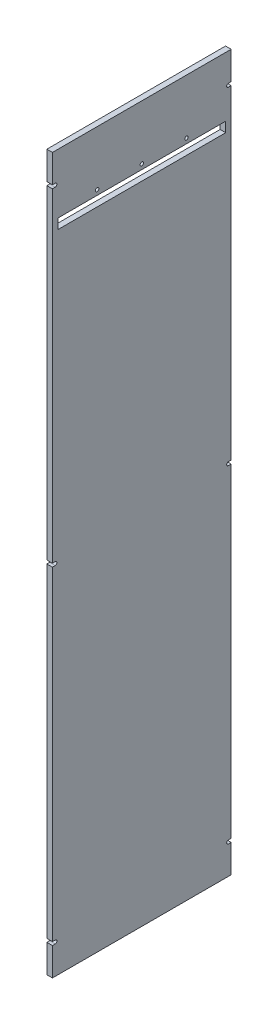
from build123d import *

# Parameters (mm, degrees)
SKETCH1_W             = 4.7625
SKETCH1_H             = 152.4
BOSS_EXTRUDE1_DEPTH   = 609.6
SKETCH2_W             = 143.129
SKETCH2_H             = 8.509
CUT_EXTRUDE1_DEPTH    = 629.379345146
F_4_CLEARANCE_HOLE1_D = 2.9464
CUT_EXTRUDE2_DEPTH    = 629.379345146


with BuildPart() as part:
    # Sketch1 → Boss-Extrude1 (new body)
    with BuildSketch(Plane(origin=(0, 0, 0), x_dir=(1, 0, 0), z_dir=(0, 1, 0))):
        with Locations((2.38125, 76.2)):
            Rectangle(SKETCH1_W, SKETCH1_H)
    extrude(amount=BOSS_EXTRUDE1_DEPTH)

    # Sketch2 → Cut-Extrude1 (cut, through all)
    with BuildSketch(Plane(origin=(4.7625, 0, 0), x_dir=(0, 0, -1), z_dir=(1, 0, 0))):
        with Locations((76.2, 554.5455)):
            Rectangle(SKETCH2_W, SKETCH2_H)
    extrude(amount=-CUT_EXTRUDE1_DEPTH, mode=Mode.SUBTRACT)

    # #4 Clearance Hole1 (through all)
    with Locations(Plane(origin=(4.7625, 0, 0), x_dir=(0, 0, -1), z_dir=(1, 0, 0))):
        with Locations((114.3, 563.0545), (76.2, 563.0545), (38.1, 563.0545)):
            Hole(F_4_CLEARANCE_HOLE1_D / 2)

    # Sketch12 → Cut-Extrude2 (cut, through all)
    with BuildSketch(Plane(origin=(4.7625, 0, 0), x_dir=(0, 0, -1), z_dir=(1, 0, 0))):
        with BuildLine():
            Line((150.01875, 23.9395), (152.4, 23.9395))
            Line((152.4, 23.9395), (152.4, 26.8605))
            Line((152.4, 26.8605), (150.01875, 26.8605))
            ThreePointArc((150.01875, 26.8605), (148.55825, 25.4), (150.01875, 23.9395))
        make_face()
        with BuildLine():
            Line((2.38125, 23.9395), (0, 23.9395))
            Line((0, 23.9395), (0, 26.8605))
            Line((0, 26.8605), (2.38125, 26.8605))
            ThreePointArc((2.38125, 26.8605), (3.84175, 25.4), (2.38125, 23.9395))
        make_face()
        with BuildLine():
            Line((0, 303.3395), (0, 306.2605))
            Line((0, 306.2605), (2.38125, 306.2605))
            ThreePointArc((2.38125, 306.2605), (3.84175, 304.8), (2.38125, 303.3395))
            Line((2.38125, 303.3395), (0, 303.3395))
        make_face()
        with BuildLine():
            Line((152.4, 303.3395), (152.4, 306.2605))
            Line((152.4, 306.2605), (150.01875, 306.2605))
            ThreePointArc((150.01875, 306.2605), (148.55825, 304.8), (150.01875, 303.3395))
            Line((150.01875, 303.3395), (152.4, 303.3395))
        make_face()
        with BuildLine():
            Line((0, 582.7395), (0, 585.6605))
            Line((0, 585.6605), (2.38125, 585.6605))
            ThreePointArc((2.38125, 585.6605), (3.84175, 584.2), (2.38125, 582.7395))
            Line((2.38125, 582.7395), (0, 582.7395))
        make_face()
        with BuildLine():
            Line((152.4, 582.7395), (152.4, 585.6605))
            Line((152.4, 585.6605), (150.01875, 585.6605))
            ThreePointArc((150.01875, 585.6605), (148.55825, 584.2), (150.01875, 582.7395))
            Line((150.01875, 582.7395), (152.4, 582.7395))
        make_face()
    extrude(amount=-CUT_EXTRUDE2_DEPTH, mode=Mode.SUBTRACT)


solid = part.part
